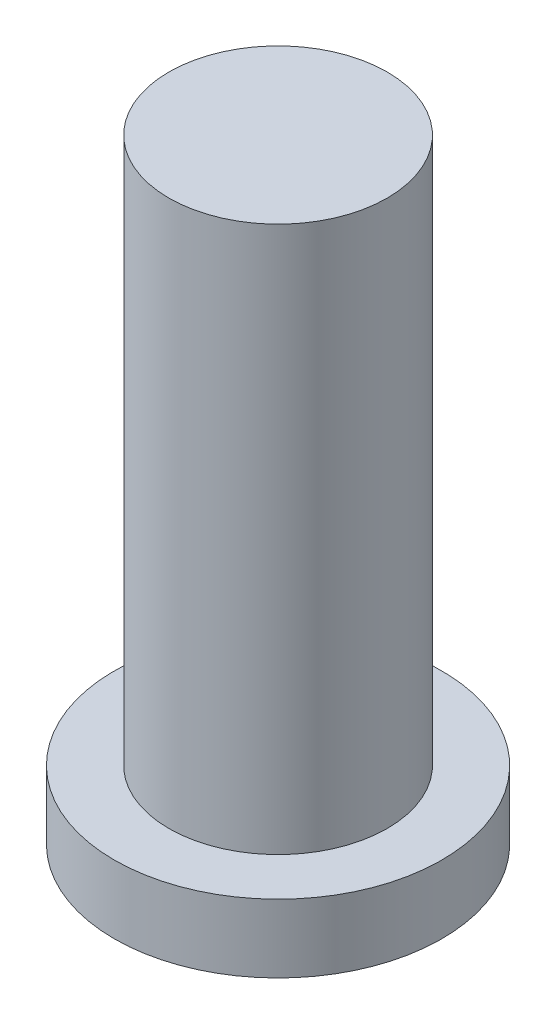
from build123d import *

# Parameters (mm, degrees)
SKETCH1_R           = 2.4
SKETCH1_R_2         = 1.6
BOSS_EXTRUDE1_DEPTH = 1
BOSS_EXTRUDE2_START = 1
SKETCH1_4_R         = 1.6
BOSS_EXTRUDE2_DEPTH = 8


with BuildPart() as part:
    # Sketch1 → Boss-Extrude1 (new body)
    # profile 1 of 2: a face of its own
    with BuildSketch(Plane(origin=(0, 0, 0), x_dir=(1, 0, 0), z_dir=(0, 1, 0))):
        with Locations(Location((0, 0, 0), (0, 0, 270))):
            Circle(SKETCH1_R)
        Circle(SKETCH1_R_2, mode=Mode.SUBTRACT)
    # profile 2 of 2: a face of its own
    with BuildSketch(Plane(origin=(0, 0, 0), x_dir=(1, 0, 0), z_dir=(0, 1, 0))):
        Circle(SKETCH1_R_2)
    extrude(amount=BOSS_EXTRUDE1_DEPTH)

    # Sketch1<4> → Boss-Extrude2 (add)
    with BuildSketch(Plane(origin=(0, 0, 0), x_dir=(1, 0, 0), z_dir=(0, 1, 0)).offset(BOSS_EXTRUDE2_START)):
        with Locations(Location((0, 0, 0), (0, 0, 270))):
            Circle(SKETCH1_4_R)
    extrude(amount=BOSS_EXTRUDE2_DEPTH)


solid = part.part
